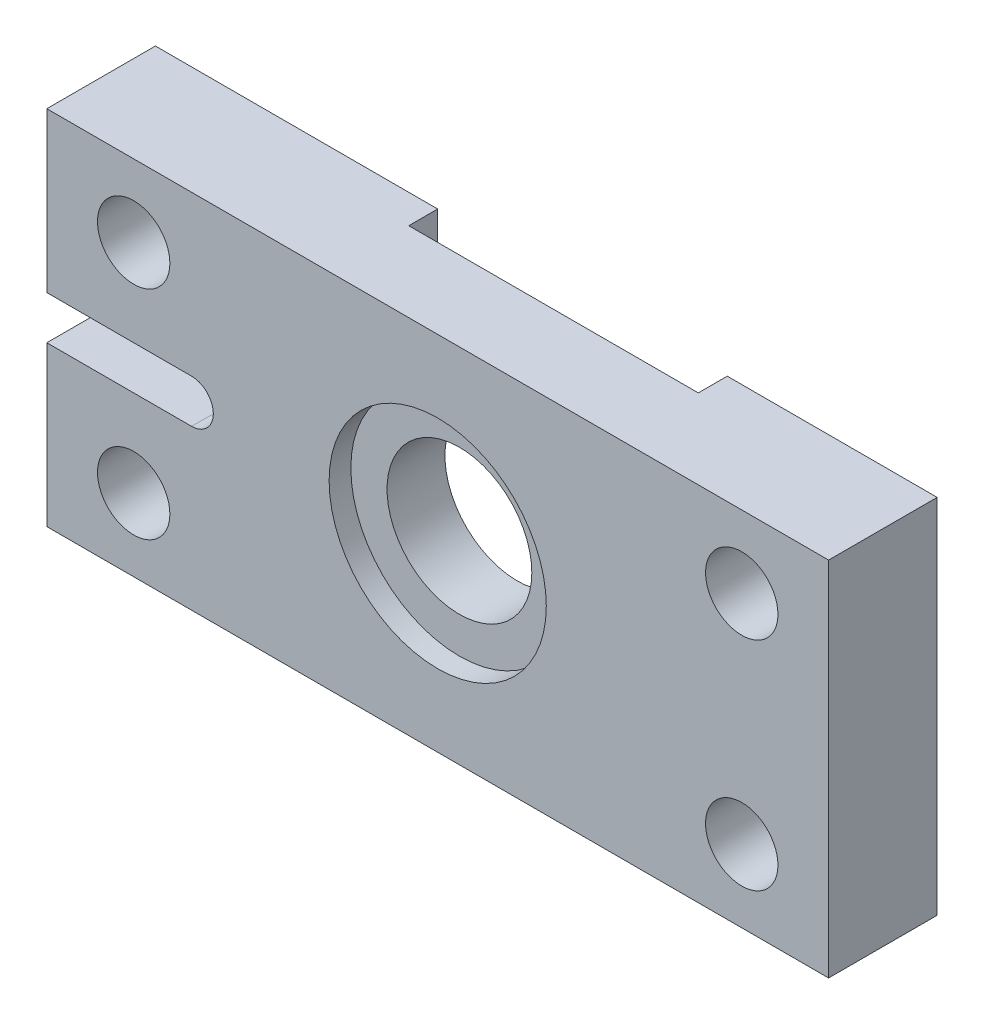
from build123d import *

# Parameters (mm, degrees)
ESBO_O1_W                = 108
ESBO_O1_H                = 50
RESSALTO_EXTRUS_O1_DEPTH = 15
ESBO_O2_R                = 10
ESBO_O2_R_2              = 5
CORTE_EXTRUS_O2_DEPTH    = 15
ESBO_O4_R                = 15
CORTE_EXTRUS_O5_DEPTH    = 3
ESBO_O5_W                = 40
ESBO_O5_H                = 4
CORTE_EXTRUS_O6_DEPTH    = 76.106590923


with BuildPart() as part:
    # Esboço1 → Ressalto-extrusão1 (new body)
    with BuildSketch(Plane.XY):
        Rectangle(ESBO_O1_W, ESBO_O1_H)
    extrude(amount=RESSALTO_EXTRUS_O1_DEPTH)

    # Esboço2 → Corte-extrusão2 (cut)
    with BuildSketch(Plane.XY):
        Circle(ESBO_O2_R)
        with Locations((42, 15)):
            Circle(ESBO_O2_R_2)
        with Locations((-42, 15)):
            Circle(ESBO_O2_R_2)
        with Locations((42, -15)):
            Circle(ESBO_O2_R_2)
        with Locations((-42, -15)):
            Circle(ESBO_O2_R_2)
        with BuildLine():
            Line((-34, 3), (-54, 3))
            Line((-54, 3), (-54, -3))
            Line((-54, -3), (-34, -3))
            ThreePointArc((-34, -3), (-31, 0), (-34, 3))
        make_face()
    extrude(amount=CORTE_EXTRUS_O2_DEPTH, mode=Mode.SUBTRACT)

    # Esboço4 → Corte-extrusão5 (cut)
    with BuildSketch(Plane.XY.offset(15)):
        Circle(ESBO_O4_R)
    extrude(amount=-CORTE_EXTRUS_O5_DEPTH, mode=Mode.SUBTRACT)

    # Esboço5 → Corte-extrusão6 (cut, through all)
    with BuildSketch(Plane.XZ.offset(25)):
        with Locations((5, 2)):
            Rectangle(ESBO_O5_W, ESBO_O5_H)
    extrude(amount=-CORTE_EXTRUS_O6_DEPTH, mode=Mode.SUBTRACT)


solid = part.part
